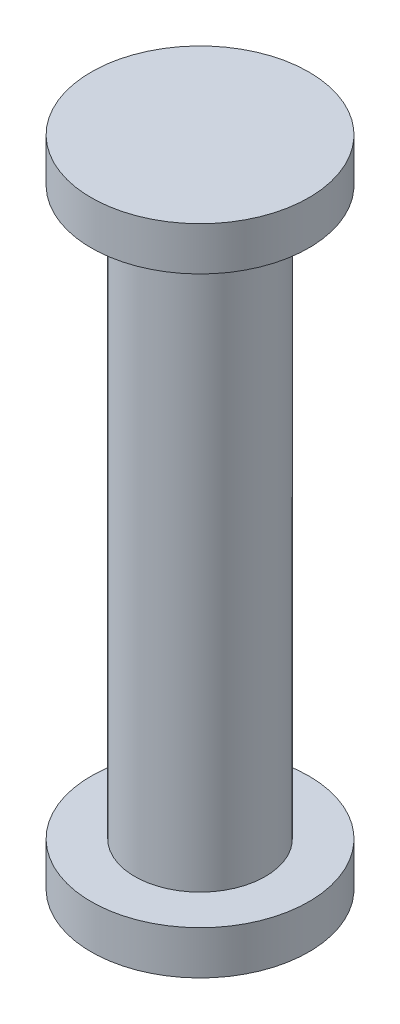
from build123d import *


with BuildPart() as part:
    # Sketch1 → Revolve1 (revolve)
    with BuildSketch(Plane.XY, mode=Mode.PRIVATE) as revolve1_sk:
        Polygon((0, 0), (0, 15), (-2.5, 15), (-2.5, 14), (-1.5, 14), (-1.5, 1), (-2.5, 1), (-2.5, 0), align=None)
    revolve(revolve1_sk.sketch.rotate(Axis((0, 0, 0), (0, 1, 0)), 270), axis=Axis((0, 0, 0), (0, 1, 0)))


solid = part.part
